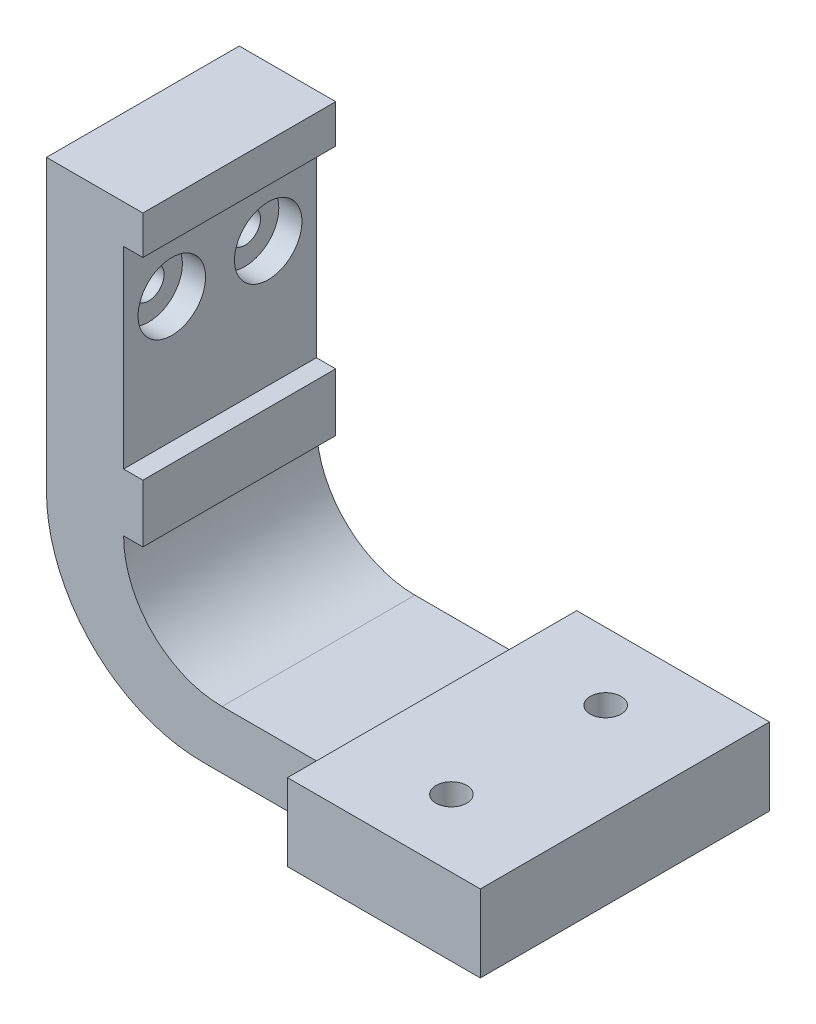
from build123d import *

# Parameters (mm, degrees)
BOSS_EXTRUDE1_DEPTH         = 5
TAP_DRILL_FOR_M2X0_4_TAP1_D = 1.6
SKETCH4_R                   = 1.75
CUT_EXTRUDE1_DEPTH          = 1.2
SKETCH5_W                   = 10
SKETCH5_H                   = 15
BOSS_EXTRUDE2_DEPTH         = 4
TAP_DRILL_FOR_M2X0_4_TAP2_D = 1.6


with BuildPart() as part:
    # Sketch1 → Boss-Extrude1 (new, symmetric)
    with BuildSketch(Plane.XY):
        with BuildLine():
            Line((-17.53737418, 3), (-17.53737418, 13))
            Line((-17.53737418, 13), (-16.53737418, 13))
            Line((-16.53737418, 13), (-16.53737418, 15))
            Line((-16.53737418, 15), (-21.53737418, 15))
            Line((-21.53737418, 15), (-21.53737418, 0))
            ThreePointArc((-21.53737418, 0), (-19.162010175, -5.734635995), (-13.42737418, -8.11))
            Line((-13.42737418, -8.11), (3.46262582, -8.11))
            Line((3.46262582, -8.11), (3.46262582, -5.11))
            Line((3.46262582, -5.11), (-12.42737418, -5.11))
            ThreePointArc((-12.42737418, -5.11), (-16.040689832, -3.613315652), (-17.53737418, 0))
            Line((-17.53737418, 0), (-16.53737418, 0))
            Line((-16.53737418, 0), (-16.53737418, 3))
            Line((-16.53737418, 3), (-17.53737418, 3))
        make_face()
    extrude(amount=BOSS_EXTRUDE1_DEPTH, both=True)

    # Tap Drill for M2x0.4 Tap1 (through all)
    with Locations(Plane(origin=(-17.53737418, 9.5, 2.5), x_dir=(0, 0, 1), z_dir=(1, 0, 0))):
        with Locations((0, 0), (-5, 0)):
            Hole(TAP_DRILL_FOR_M2X0_4_TAP1_D / 2)

    # Sketch4 → Cut-Extrude1 (cut)
    with BuildSketch(Plane(origin=(-17.53737418, 0, 0), x_dir=(0, 0, -1), z_dir=(1, 0, 0))):
        with Locations((-2.5, 9.5)):
            Circle(SKETCH4_R)
        with Locations((2.5, 9.5)):
            Circle(SKETCH4_R)
    extrude(amount=-CUT_EXTRUDE1_DEPTH, mode=Mode.SUBTRACT)

    # Sketch5 → Boss-Extrude2 (add)
    with BuildSketch(Plane.XZ.offset(8.11)):
        with Locations((-1.53737418, 0)):
            Rectangle(SKETCH5_W, SKETCH5_H)
    extrude(amount=-BOSS_EXTRUDE2_DEPTH)

    # Tap Drill for M2x0.4 Tap2 (through all)
    with Locations(Plane(origin=(-1.53737418, -4.11, 4), x_dir=(0, 0, 1), z_dir=(0, 1, 0))):
        with Locations((0, 0), (-8, 0)):
            Hole(TAP_DRILL_FOR_M2X0_4_TAP2_D / 2)


solid = part.part
